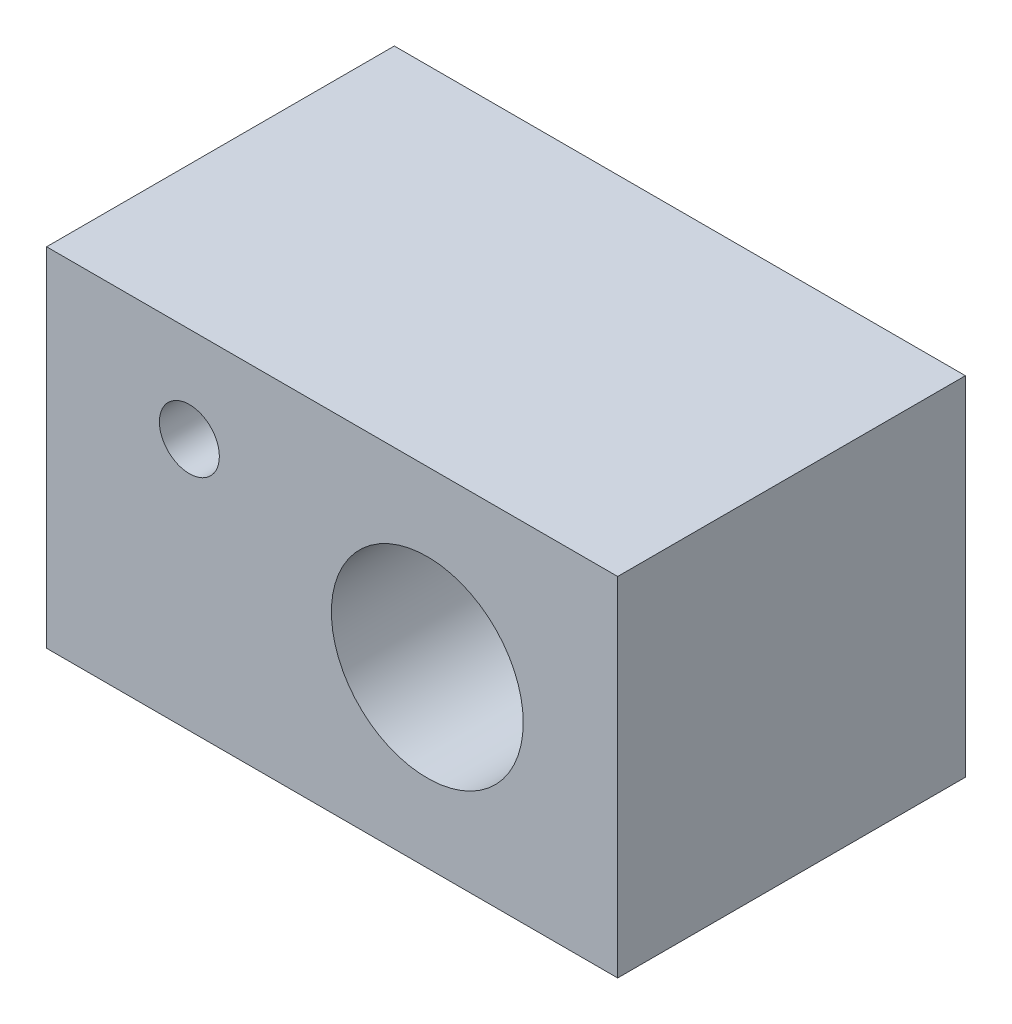
from build123d import *

# Parameters (mm, degrees)
SKETCH1_W                = 9.525
SKETCH1_H                = 5.8
BOSS_EXTRUDE1_DEPTH      = 5.8
M3_CLEARANCE_HOLE1_D     = 3.2
M3_CLEARANCE_HOLE1_DEPTH = 12.7
M3_CLEARANCE_HOLE1_TIP   = 0.96137699
SKETCH5_R                = 0.5
CUT_EXTRUDE1_DEPTH       = 5.8


with BuildPart() as part:
    # Sketch1 → Boss-Extrude1 (new body)
    with BuildSketch(Plane.XY):
        with Locations((4.7625, 2.9)):
            Rectangle(SKETCH1_W, SKETCH1_H)
    extrude(amount=BOSS_EXTRUDE1_DEPTH)

    # M3 Clearance Hole1
    with Locations(Plane.XY.offset(5.8)):
        with Locations((6.35, 2.9)):
            Hole(M3_CLEARANCE_HOLE1_D / 2, depth=M3_CLEARANCE_HOLE1_DEPTH)
            with Locations((0, 0, -(M3_CLEARANCE_HOLE1_DEPTH + M3_CLEARANCE_HOLE1_TIP / 2))):  # 118° drill point
                Cone(0, M3_CLEARANCE_HOLE1_D / 2, M3_CLEARANCE_HOLE1_TIP, mode=Mode.SUBTRACT)

    # Sketch5 → Cut-Extrude1 (cut)
    with BuildSketch(Plane.XY.offset(5.8)):
        with Locations((2.38125, 4.2125)):
            Circle(SKETCH5_R)
    extrude(amount=-CUT_EXTRUDE1_DEPTH, mode=Mode.SUBTRACT)


solid = part.part
